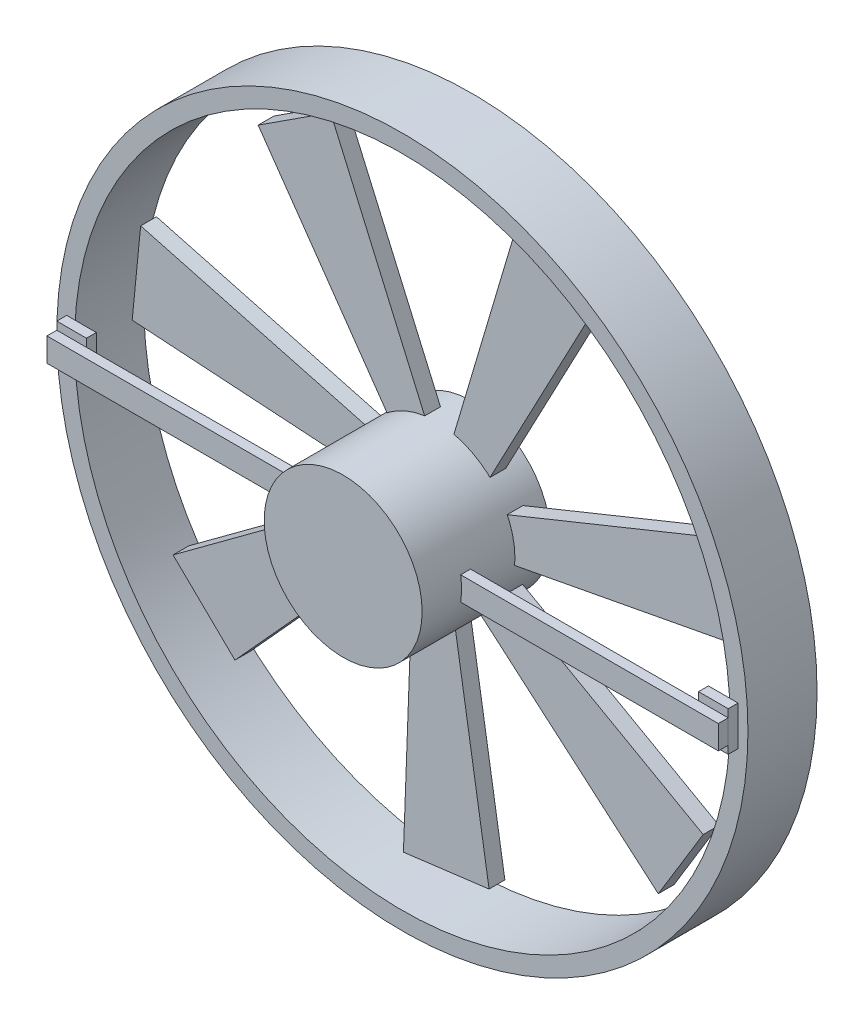
from build123d import *

# Parameters (mm, degrees)
FAN_HOUSING_OD350_ASSUMED_START  = 380
SKETCH1_R                        = 175
SKETCH1_R_2                      = 166
FAN_HOUSING_OD350_ASSUMED_DEPTH  = 35
FAN_MOTOR_ENVELOPE_ASSUMED_START = 380
SKETCH2_R                        = 40
FAN_MOTOR_ENVELOPE_ASSUMED_DEPTH = 65
BLADE_1_VISUAL_ONLY_START        = 390
BLADE_1_VISUAL_ONLY_DEPTH        = 8
BLADE_2_VISUAL_ONLY_START        = 390
BLADE_2_VISUAL_ONLY_DEPTH        = 8
BLADE_3_VISUAL_ONLY_START        = 390
BLADE_3_VISUAL_ONLY_DEPTH        = 8
BLADE_4_VISUAL_ONLY_START        = 390
BLADE_4_VISUAL_ONLY_DEPTH        = 8
BLADE_5_VISUAL_ONLY_START        = 390
BLADE_5_VISUAL_ONLY_DEPTH        = 8
BLADE_6_VISUAL_ONLY_START        = 390
BLADE_6_VISUAL_ONLY_DEPTH        = 8
BLADE_7_VISUAL_ONLY_START        = 390
BLADE_7_VISUAL_ONLY_DEPTH        = 8
MOTOR_SUPPORT_STRUT_START        = 415
SKETCH10_W                       = 15
SKETCH10_H                       = 20
MOTOR_SUPPORT_STRUT_DEPTH        = 5
BOSS_EXTRUDE11_START             = 415
SKETCH11_W                       = 15
SKETCH11_H                       = 20
BOSS_EXTRUDE11_DEPTH             = 5
MOTOR_SUPPORT_BRIDGE_START       = 420
SKETCH12_W                       = 340
SKETCH12_H                       = 12
MOTOR_SUPPORT_BRIDGE_DEPTH       = 5


with BuildPart() as part:
    # Sketch1 → Fan_housing_OD350_ASSUMED (new body)
    with BuildSketch(Plane.XY.offset(FAN_HOUSING_OD350_ASSUMED_START)):
        with Locations((0, 250)):
            Circle(SKETCH1_R)
        with Locations((0, 250)):
            Circle(SKETCH1_R_2, mode=Mode.SUBTRACT)
    extrude(amount=FAN_HOUSING_OD350_ASSUMED_DEPTH)


with BuildPart() as body_2:
    # Sketch2 → Fan_motor_envelope_ASSUMED (new body)
    with BuildSketch(Plane.XY.offset(FAN_MOTOR_ENVELOPE_ASSUMED_START)):
        with Locations((0, 250)):
            Circle(SKETCH2_R)
    extrude(amount=FAN_MOTOR_ENVELOPE_ASSUMED_DEPTH)


with BuildPart() as body_3:
    # Sketch3 → Blade_1_VISUAL_ONLY (new body)
    with BuildSketch(Plane.XY.offset(BLADE_1_VISUAL_ONLY_START)):
        Polygon((31.640674494, 245.217979761), (156.863764465, 268.914528752), (141.843393076, 309.970424716), (32.416095685, 265.658759228), align=None)
    extrude(amount=BLADE_1_VISUAL_ONLY_DEPTH)


with BuildPart() as body_4:
    # Sketch4 → Blade_2_VISUAL_ONLY (new body)
    with BuildSketch(Plane.XY.offset(BLADE_2_VISUAL_ONLY_START)):
        Polygon((23.466371844, 271.756134595), (83.014983371, 384.434045301), (41.551142985, 398.288578511), (7.968594135, 285.107000833), align=None)
    extrude(amount=BLADE_2_VISUAL_ONLY_DEPTH)


with BuildPart() as body_5:
    # Sketch5 → Blade_3_VISUAL_ONLY (new body)
    with BuildSketch(Plane.XY.offset(BLADE_3_VISUAL_ONLY_START)):
        Polygon((-2.378587432, 281.911476334), (-53.345773398, 398.721983784), (-90.029965263, 374.942408151), (-22.479421328, 278.118954759), align=None)
    extrude(amount=BLADE_3_VISUAL_ONLY_DEPTH)


with BuildPart() as body_6:
    # Sketch6 → Blade_4_VISUAL_ONLY (new body)
    with BuildSketch(Plane.XY.offset(BLADE_4_VISUAL_ONLY_START)):
        Polygon((-26.432421857, 268.036825519), (-149.536074743, 301.019235102), (-153.816673392, 257.512056094), (-35.999974035, 249.956762229), align=None)
    extrude(amount=BLADE_4_VISUAL_ONLY_DEPTH)


with BuildPart() as body_7:
    # Sketch7 → Blade_5_VISUAL_ONLY (new body)
    with BuildSketch(Plane.XY.offset(BLADE_5_VISUAL_ONLY_START)):
        Polygon((-30.5821035, 240.580077204), (-133.122661826, 164.897961786), (-101.776289167, 134.424972579), (-22.411812027, 221.827128622), align=None)
    extrude(amount=BLADE_5_VISUAL_ONLY_DEPTH)


with BuildPart() as body_8:
    # Sketch8 → Blade_6_VISUAL_ONLY (new body)
    with BuildSketch(Plane.XY.offset(BLADE_6_VISUAL_ONLY_START)):
        Polygon((-11.702837447, 220.216722885), (-16.465169347, 92.86025901), (26.903716658, 98.368242014), (8.052901555, 214.912241785), align=None)
    extrude(amount=BLADE_6_VISUAL_ONLY_DEPTH)


with BuildPart() as body_9:
    # Sketch9 → Blade_7_VISUAL_ONLY (new body)
    with BuildSketch(Plane.XY.offset(BLADE_7_VISUAL_ONLY_START)):
        Polygon((15.988903898, 222.280783703), (112.590931479, 139.151986266), (135.324675104, 176.493317936), (32.453616016, 234.419152543), align=None)
    extrude(amount=BLADE_7_VISUAL_ONLY_DEPTH)


with BuildPart() as body_10:
    # Sketch10 → Motor_support_strut (new body)
    with BuildSketch(Plane.XY.offset(MOTOR_SUPPORT_STRUT_START)):
        with Locations((-162.5, 250)):
            Rectangle(SKETCH10_W, SKETCH10_H)
    extrude(amount=MOTOR_SUPPORT_STRUT_DEPTH)


with BuildPart() as body_11:
    # Sketch11 → Boss-Extrude11 (new body)
    with BuildSketch(Plane.XY.offset(BOSS_EXTRUDE11_START)):
        with Locations((162.5, 250)):
            Rectangle(SKETCH11_W, SKETCH11_H)
    extrude(amount=BOSS_EXTRUDE11_DEPTH)


with BuildPart() as body_12:
    # Sketch12 → Motor_support_bridge (new body)
    with BuildSketch(Plane.XY.offset(MOTOR_SUPPORT_BRIDGE_START)):
        with Locations((0, 250)):
            Rectangle(SKETCH12_W, SKETCH12_H)
    extrude(amount=MOTOR_SUPPORT_BRIDGE_DEPTH)


solid = Compound([part.part, body_2.part, body_3.part, body_4.part, body_5.part, body_6.part, body_7.part, body_8.part, body_9.part, body_10.part, body_11.part, body_12.part])
